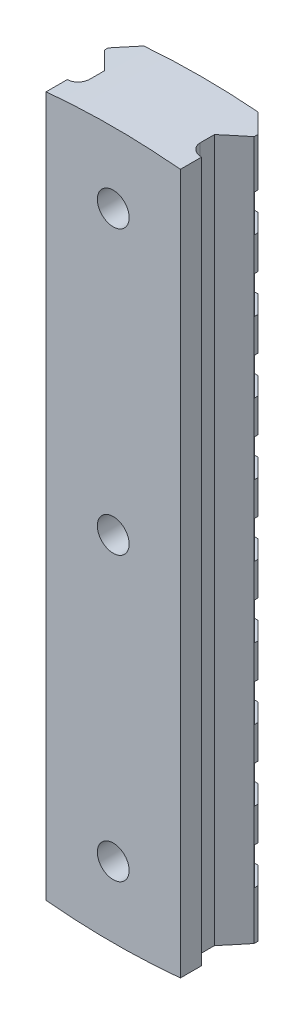
from build123d import *

# Parameters (mm, degrees)
BOSS_EXTRUDE1_DEPTH                                 = 50
SKETCH2_W                                           = 5
SKETCH2_H                                           = 5.25
CUT_EXTRUDE1_DEPTH                                  = 50
LPATTERN1_COUNT                                     = 5
LPATTERN1_PITCH                                     = 10
LPATTERN1_COL_COUNT                                 = 5
LPATTERN1_COL_PITCH                                 = 10
SKETCH3_OUTSIDE_W                                   = 43.794
SKETCH3_OUTSIDE_H                                   = 122.594
CUT_EXTRUDE2_DEPTH                                  = 50
CBORE_FOR_M4_HEX_SOCKET_HEAD_CAP_SCREW1_D           = 4.5
CBORE_FOR_M4_HEX_SOCKET_HEAD_CAP_SCREW1_CBORE_D     = 8
CBORE_FOR_M4_HEX_SOCKET_HEAD_CAP_SCREW1_CBORE_DEPTH = 4.4


with BuildPart() as part:
    # Sketch1 → Boss-Extrude1 (new, symmetric)
    with BuildSketch(Plane(origin=(0, 0, 0), x_dir=(1, 0, 0), z_dir=(0, 1, 0))):
        with BuildLine():
            Line((-8.07, 12.4), (8.07, 12.4))
            Line((8.07, 12.4), (10.6, 9.87))
            Line((10.6, 9.87), (10.6, 9.33))
            Line((10.6, 9.33), (7.8, 6.53))
            Line((7.8, 6.53), (7.8, 4.5))
            ThreePointArc((7.8, 4.5), (8.239339828, 3.439339828), (9.3, 3))
            Line((9.3, 3), (9.5, 3))
            Line((9.5, 3), (9.5, 0))
            Line((9.5, 0), (-9.5, 0))
            Line((-9.5, 0), (-9.5, 3))
            Line((-9.5, 3), (-9.3, 3))
            ThreePointArc((-9.3, 3), (-8.239339828, 3.439339828), (-7.8, 4.5))
            Line((-7.8, 4.5), (-7.8, 6.53))
            Line((-7.8, 6.53), (-10.6, 9.33))
            Line((-10.6, 9.33), (-10.6, 9.87))
            Line((-10.6, 9.87), (-8.07, 12.4))
        make_face()
    extrude(amount=BOSS_EXTRUDE1_DEPTH, both=True)

    # Sketch2 → Cut-Extrude1 (cut, symmetric)
    with BuildSketch(Plane(origin=(0, 0, 0), x_dir=(0, 0, -1), z_dir=(1, 0, 0))):
        with Locations((11.9, 0)):
            Rectangle(SKETCH2_W, SKETCH2_H)
    cut_extrude1 = extrude(amount=CUT_EXTRUDE1_DEPTH, both=True, mode=Mode.SUBTRACT)

    # LPattern1: Cut-Extrude1 ×5
    with Locations(*[(0, i * LPATTERN1_PITCH, 0) for i in range(1, LPATTERN1_COUNT)]):
        add(cut_extrude1, mode=Mode.SUBTRACT)

    # LPattern1 col: Cut-Extrude1 ×5
    with Locations(*[(0, -i * LPATTERN1_COL_PITCH, 0) for i in range(1, LPATTERN1_COL_COUNT)]):
        add(cut_extrude1, mode=Mode.SUBTRACT)

    # Sketch3 outside → Cut-Extrude2 (cut, symmetric)
    with BuildSketch(Plane.XY):
        Rectangle(SKETCH3_OUTSIDE_W, SKETCH3_OUTSIDE_H)
        with BuildLine():
            Line((-15, 48.868599666), (-15, -48.868599666))
            ThreePointArc((-15, -48.868599666), (0, -50), (15, -48.868599666))
            Line((15, -48.868599666), (15, 48.868599666))
            ThreePointArc((15, 48.868599666), (0, 50), (-15, 48.868599666))
        make_face(mode=Mode.SUBTRACT)
    extrude(amount=CUT_EXTRUDE2_DEPTH, both=True, mode=Mode.SUBTRACT)

    # CBORE for M4 Hex Socket Head Cap Screw1 (through all)
    with Locations(Plane(origin=(0, 0, -12.4), x_dir=(-1, 0, 0), z_dir=(0, 0, -1))):
        with Locations((0, 40), (0, -40), (0, 0)):
            CounterBoreHole(CBORE_FOR_M4_HEX_SOCKET_HEAD_CAP_SCREW1_D / 2, CBORE_FOR_M4_HEX_SOCKET_HEAD_CAP_SCREW1_CBORE_D / 2, CBORE_FOR_M4_HEX_SOCKET_HEAD_CAP_SCREW1_CBORE_DEPTH)


solid = part.part
